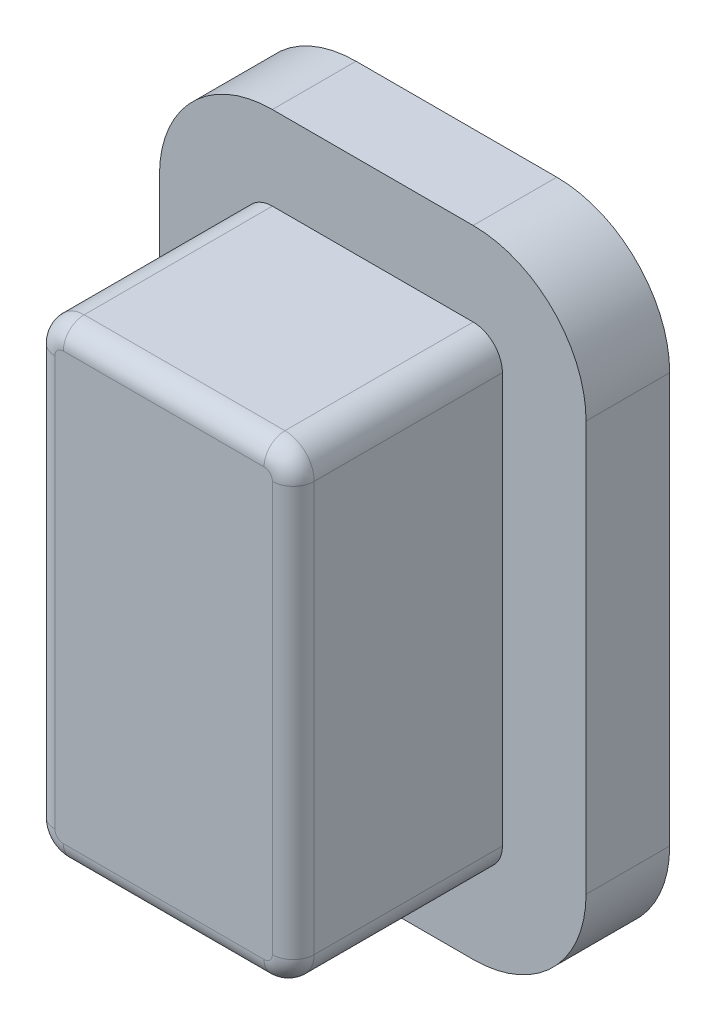
from build123d import *

# Parameters (mm, degrees)
CROQUIS1_W              = 9.2
CROQUIS1_H              = 4.2
SALIENTE_EXTRUIR1_DEPTH = 7
SALIENTE_EXTRUIR2_DEPTH = 2
SALIENTE_EXTRUIR3_START = 7
CROQUIS1_5_W            = 9.2
CROQUIS1_5_H            = 4.2
CROQUIS1_5_R            = 1.647263677
SALIENTE_EXTRUIR3_DEPTH = 1
SALIENTE_EXTRUIR4_START = 7
CROQUIS1_6_R            = 1.647263677
SALIENTE_EXTRUIR4_DEPTH = 7
CORTAR_EXTRUIR1_START   = -1.3
CROQUIS2_W              = 4.2
CROQUIS2_H              = 7
CROQUIS2_R              = 1.647263677
CROQUIS2_W_2            = 1.4
CORTAR_EXTRUIR1_DEPTH   = 1.3
REDONDEO1_R             = 0.5


with BuildPart() as part:
    # Croquis1 → Saliente-Extruir1 (new body)
    with BuildSketch(Plane(origin=(0, 0, 0), x_dir=(0, 1, 0), z_dir=(0, 0, 1))):
        with BuildLine():
            ThreePointArc((-5.6, 2.4), (-5.394974747, 2.894974747), (-4.9, 3.1))
            Line((-4.9, 3.1), (4.9, 3.1))
            ThreePointArc((4.9, 3.1), (5.394974747, 2.894974747), (5.6, 2.4))
            Line((5.6, 2.4), (5.6, -2.4))
            ThreePointArc((5.6, -2.4), (5.394974747, -2.894974747), (4.9, -3.1))
            Line((4.9, -3.1), (-4.9, -3.1))
            ThreePointArc((-4.9, -3.1), (-5.394974747, -2.894974747), (-5.6, -2.4))
            Line((-5.6, -2.4), (-5.6, 2.4))
        make_face()
        Rectangle(CROQUIS1_W, CROQUIS1_H, mode=Mode.SUBTRACT)
    extrude(amount=SALIENTE_EXTRUIR1_DEPTH)

    # Croquis1<4> → Saliente-Extruir2 (add)
    with BuildSketch(Plane(origin=(0, 0, 0), x_dir=(0, 1, 0), z_dir=(0, 0, 1))):
        with BuildLine():
            ThreePointArc((-4.9, -5.1), (-6.809188309, -4.309188309), (-7.6, -2.4))
            Line((-7.6, -2.4), (-7.6, 2.4))
            ThreePointArc((-7.6, 2.4), (-6.809188309, 4.309188309), (-4.9, 5.1))
            Line((-4.9, 5.1), (4.9, 5.1))
            ThreePointArc((4.9, 5.1), (6.809188309, 4.309188309), (7.6, 2.4))
            Line((7.6, 2.4), (7.6, -2.4))
            ThreePointArc((7.6, -2.4), (6.809188309, -4.309188309), (4.9, -5.1))
            Line((4.9, -5.1), (-4.9, -5.1))
        make_face()
        with BuildLine():
            Line((-5.6, -2.4), (-5.6, 2.4))
            ThreePointArc((-5.6, 2.4), (-5.394974747, 2.894974747), (-4.9, 3.1))
            Line((-4.9, 3.1), (4.9, 3.1))
            ThreePointArc((4.9, 3.1), (5.394974747, 2.894974747), (5.6, 2.4))
            Line((5.6, 2.4), (5.6, -2.4))
            ThreePointArc((5.6, -2.4), (5.394974747, -2.894974747), (4.9, -3.1))
            Line((4.9, -3.1), (-4.9, -3.1))
            ThreePointArc((-4.9, -3.1), (-5.394974747, -2.894974747), (-5.6, -2.4))
        make_face(mode=Mode.SUBTRACT)
    extrude(amount=SALIENTE_EXTRUIR2_DEPTH)

    # Croquis1<5> → Saliente-Extruir3 (add)
    with BuildSketch(Plane(origin=(0, 0, 0), x_dir=(0, 1, 0), z_dir=(0, 0, 1)).offset(SALIENTE_EXTRUIR3_START)):
        Rectangle(CROQUIS1_5_W, CROQUIS1_5_H)
        with Locations(Location((0, 0, 0), (0, 0, 270))):
            Circle(CROQUIS1_5_R, mode=Mode.SUBTRACT)
    extrude(amount=-SALIENTE_EXTRUIR3_DEPTH)

    # Croquis1<6> → Saliente-Extruir4 (add)
    with BuildSketch(Plane(origin=(0, 0, 0), x_dir=(0, 1, 0), z_dir=(0, 0, 1)).offset(SALIENTE_EXTRUIR4_START)):
        with Locations(Location((0, 0, 0), (0, 0, 270))):
            Circle(CROQUIS1_6_R)
    extrude(amount=-SALIENTE_EXTRUIR4_DEPTH)

    # Croquis2 → Cortar-Extruir1 (cut)
    # profile 1 of 3: a face of its own
    with BuildSketch(Plane(origin=(0, 0, 0), x_dir=(1, 0, 0), z_dir=(0, 0, -1)).offset(CORTAR_EXTRUIR1_START)):
        Rectangle(CROQUIS2_W, CROQUIS2_H)
        Circle(CROQUIS2_R, mode=Mode.SUBTRACT)
    # profile 2 of 3: a face of its own
    with BuildSketch(Plane(origin=(0, 0, 0), x_dir=(1, 0, 0), z_dir=(0, 0, -1)).offset(CORTAR_EXTRUIR1_START)):
        with Locations((-2.8, 0)):
            Rectangle(CROQUIS2_W_2, CROQUIS2_H)
    # profile 3 of 3: a face of its own
    with BuildSketch(Plane(origin=(0, 0, 0), x_dir=(1, 0, 0), z_dir=(0, 0, -1)).offset(CORTAR_EXTRUIR1_START)):
        with Locations((2.8, 0)):
            Rectangle(CROQUIS2_W_2, CROQUIS2_H)
    extrude(amount=CORTAR_EXTRUIR1_DEPTH, mode=Mode.SUBTRACT)

    # Redondeo1
    redondeo1_edges = [part.edges().sort_by_distance(p)[0] for p in [
        (0, -5.6, 7),
        (2.894974747, -5.394974747, 7),
        (3.1, 0, 7),
        (2.894974747, 5.394974747, 7),
        (0, 5.6, 7),
        (-2.894974747, 5.394974747, 7),
        (-3.1, 0, 7),
        (-2.894974747, -5.394974747, 7),
    ]]
    fillet(redondeo1_edges, radius=REDONDEO1_R)


solid = part.part
